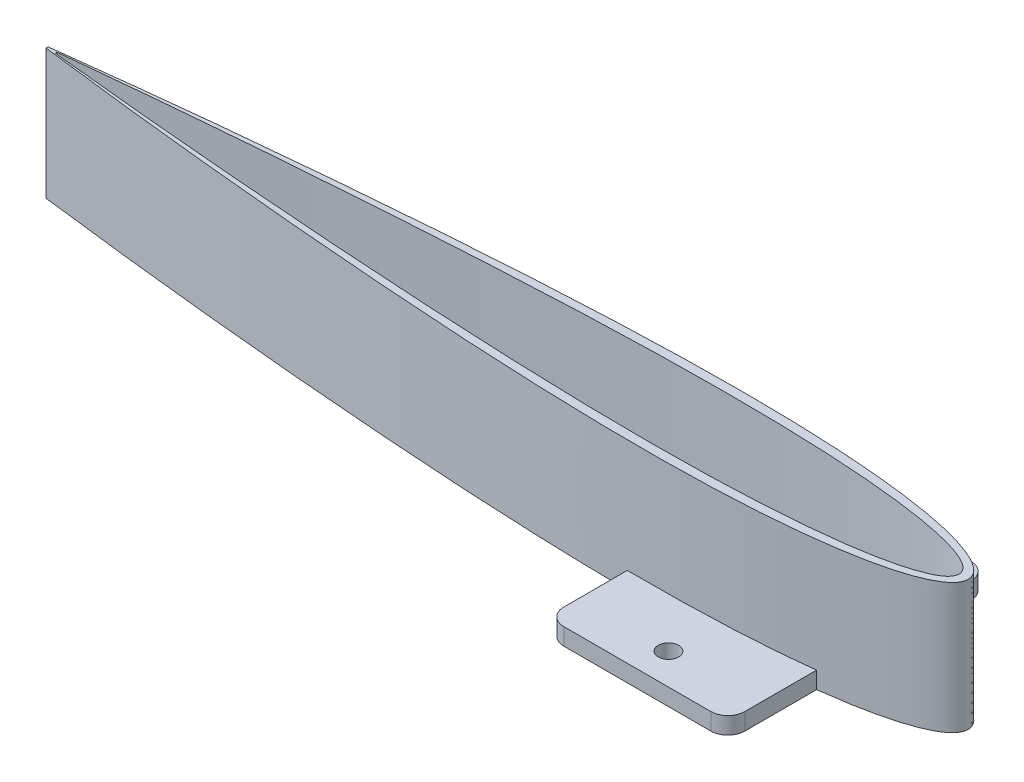
from build123d import *

# Parameters (mm, degrees)
BOSS_EXTRUDE1_DEPTH = 23
BOSS_EXTRUDE2_DEPTH = 3
CUT_EXTRUDE1_DEPTH  = 20
SKETCH4_R           = 1.8
CUT_EXTRUDE2_DEPTH  = 3


with BuildPart() as part:
    # Sketch1 → Boss-Extrude1 (new body)
    with BuildSketch(Plane(origin=(0, 0, 0), x_dir=(1, 0, 0), z_dir=(0, 1, 0))):
        with BuildLine():
            Line((-161.284, 0.18450138), (-161.284, -0.18450138))
            add(Edge.make_bspline(
                [(-161.284, 0.18450138), (-161.135285552, 0.203239863), (-160.542103526, 0.277982643), (-159.213544996, 0.444104262), (-157.015453139, 0.715408296), (-153.971872979, 1.083724041), (-150.116132303, 1.538612136), (-145.490452745, 2.067758404), (-140.145504077, 2.657679862), (-134.139845429, 3.29416917), (-127.53928397, 3.962606617), (-120.416149384, 4.648044144), (-112.848495933, 5.3351116), (-104.919240653, 6.007807533), (-96.715248395, 6.649280014), (-88.326374672, 7.241712468), (-79.84447799, 7.766420282), (-71.362413467, 8.204231159), (-62.97301895, 8.536172364), (-54.768103928, 8.744428726), (-46.837447754, 8.813478491), (-39.267816891, 8.731264117), (-32.14198666, 8.490243969), (-25.537819723, 8.088124773), (-19.527199646, 7.528268837), (-14.175386999, 6.819291704), (-9.538717204, 5.975150055), (-5.666260379, 5.01168712), (-2.58646106, 3.951109869), (-0.325415931, 2.797166623), (1.177544817, 1.549374974), (1.783091046, 0), (1.177544817, -1.549374974), (-0.325415931, -2.797166623), (-2.58646106, -3.951109869), (-5.666260379, -5.01168712), (-9.538717204, -5.975150055), (-14.175386999, -6.819291704), (-19.527199646, -7.528268837), (-25.537819723, -8.088124773), (-32.14198666, -8.490243969), (-39.267816891, -8.731264117), (-46.837447754, -8.813478491), (-54.768103928, -8.744428726), (-62.97301895, -8.536172364), (-71.362413467, -8.204231159), (-79.84447799, -7.766420282), (-88.326374672, -7.241712468), (-96.715248395, -6.649280014), (-104.919240653, -6.007807533), (-112.848495933, -5.3351116), (-120.416149384, -4.648044144), (-127.53928397, -3.962606617), (-134.139845429, -3.29416917), (-140.145504077, -2.657679862), (-145.490452745, -2.067758404), (-150.116132303, -1.538612136), (-153.971872979, -1.083724041), (-157.015453139, -0.715408296), (-159.213544996, -0.444104262), (-160.542103526, -0.277982643), (-161.135285552, -0.203239863), (-161.284, -0.18450138)],
                knots=[0, 0, 0, 0, 0.00135831, 0.005417933, 0.012133176, 0.021428608, 0.03320011, 0.047316244, 0.063619895, 0.081930134, 0.102044264, 0.123740032, 0.146778017, 0.170904207, 0.195852777, 0.221349083, 0.247112878, 0.272861715, 0.298314501, 0.323195095, 0.34723587, 0.370181113, 0.391790201, 0.411840564, 0.430130584, 0.446482834, 0.460748495, 0.472814827, 0.482620397, 0.490191984, 0.49574923, 0.5, 0.50425077, 0.509808016, 0.517379603, 0.527185173, 0.539251505, 0.553517166, 0.569869416, 0.588159436, 0.608209799, 0.629818887, 0.65276413, 0.676804905, 0.701685499, 0.727138285, 0.752887122, 0.778650917, 0.804147223, 0.829095793, 0.853221983, 0.876259968, 0.897955736, 0.918069866, 0.936380105, 0.952683756, 0.96679989, 0.978571392, 0.987866824, 0.994582067, 0.99864169, 1, 1, 1, 1], degree=3))
        make_face()
    extrude(amount=BOSS_EXTRUDE1_DEPTH)

    # Sketch2 → Boss-Extrude2 (add)
    with BuildSketch(Plane(origin=(0, 0, 0), x_dir=(1, 0, 0), z_dir=(0, 1, 0))):
        with BuildLine():
            Line((-46.9, -23), (-20.9, -23))
            ThreePointArc((-20.9, -23), (-18.778679656, -22.121320344), (-17.9, -20))
            Line((-17.9, -20), (-17.9, 20))
            ThreePointArc((-17.9, 20), (-18.778679656, 22.121320344), (-20.9, 23))
            Line((-20.9, 23), (-46.9, 23))
            ThreePointArc((-46.9, 23), (-49.021320344, 22.121320344), (-49.9, 20))
            Line((-49.9, 20), (-49.9, -20))
            ThreePointArc((-49.9, -20), (-49.021320344, -22.121320344), (-46.9, -23))
        make_face()
    extrude(amount=BOSS_EXTRUDE2_DEPTH)

    # Sketch3 → Cut-Extrude1 (cut)
    with BuildSketch(Plane(origin=(0, 23, 0), x_dir=(1, 0, 0), z_dir=(0, 1, 0))):
        with BuildLine():
            Line((-159.684, 0.15090138), (-159.684, -0.15090138))
            add(Edge.make_bspline(
                [(-159.684, 0.15090138), (-159.538206741, 0.166227398), (-158.956662871, 0.227360207), (-157.654167736, 0.363232866), (-155.499199594, 0.585135074), (-152.515342829, 0.886382703), (-148.735276621, 1.258436775), (-144.200400621, 1.691224844), (-138.960392936, 2.173718981), (-133.072663344, 2.694299117), (-126.601724472, 3.241008162), (-119.618481877, 3.801620551), (-112.199453433, 4.363565395), (-104.425926457, 4.913755218), (-96.383062672, 5.438406618), (-88.158961465, 5.922946918), (-79.843692488, 6.352093411), (-71.52830892, 6.710164856), (-63.303852195, 6.981644343), (-55.260358793, 7.151963366), (-47.485875905, 7.208432976), (-40.065498905, 7.14119841), (-33.080413103, 6.944115154), (-26.607014754, 6.615303653), (-20.715852923, 6.157651069), (-15.471178936, 5.577990947), (-10.928400576, 4.888852637), (-7.137110149, 4.100965219), (-4.125063263, 3.241407304), (-1.924485135, 2.297674875), (-0.458501505, 1.322679617), (0.189557065, 0), (-0.458501505, -1.322679617), (-1.924485135, -2.297674875), (-4.125063263, -3.241407304), (-7.137110149, -4.100965219), (-10.928400576, -4.888852637), (-15.471178936, -5.577990947), (-20.715852923, -6.157651069), (-26.607014754, -6.615303653), (-33.080413103, -6.944115154), (-40.065498905, -7.14119841), (-47.485875905, -7.208432976), (-55.260358793, -7.151963366), (-63.303852195, -6.981644343), (-71.52830892, -6.710164856), (-79.843692488, -6.352093411), (-88.158961465, -5.922946918), (-96.383062672, -5.438406618), (-104.425926457, -4.913755218), (-112.199453433, -4.363565395), (-119.618481877, -3.801620551), (-126.601724472, -3.241008162), (-133.072663344, -2.694299117), (-138.960392936, -2.173718981), (-144.200400621, -1.691224844), (-148.735276621, -1.258436775), (-152.515342829, -0.886382703), (-155.499199594, -0.585135074), (-157.654167736, -0.363232866), (-158.956662871, -0.227360207), (-159.538206741, -0.166227398), (-159.684, -0.15090138)],
                knots=[0, 0, 0, 0, 0.001360811, 0.005428038, 0.012156267, 0.021470482, 0.03326704, 0.047414968, 0.063757539, 0.082114088, 0.102282038, 0.12403911, 0.147145729, 0.171347612, 0.196378555, 0.221963406, 0.247821218, 0.273668571, 0.299222988, 0.324206394, 0.348348543, 0.371390297, 0.393086736, 0.413210068, 0.431552463, 0.44792908, 0.462181893, 0.474185722, 0.483860131, 0.491198837, 0.496361358, 0.5, 0.503638642, 0.508801163, 0.516139869, 0.525814278, 0.537818107, 0.55207092, 0.568447537, 0.586789932, 0.606913264, 0.628609703, 0.651651457, 0.675793606, 0.700777012, 0.726331429, 0.752178782, 0.778036594, 0.803621445, 0.828652388, 0.852854271, 0.87596089, 0.897717962, 0.917885912, 0.936242461, 0.952585032, 0.96673296, 0.978529518, 0.987843733, 0.994571962, 0.998639189, 1, 1, 1, 1], degree=3))
        make_face()
    extrude(amount=-CUT_EXTRUDE1_DEPTH, mode=Mode.SUBTRACT)

    # Sketch4 → Cut-Extrude2 (cut)
    with BuildSketch(Plane(origin=(0, 0, 0), x_dir=(1, 0, 0), z_dir=(0, 1, 0))):
        with Locations(Location((-33.9, -17.5, 0), (0, 0, 270))):
            Circle(SKETCH4_R)
        with Locations(Location((-33.9, 17.5, 0), (0, 0, 270))):
            Circle(SKETCH4_R)
    extrude(amount=CUT_EXTRUDE2_DEPTH, mode=Mode.SUBTRACT)


solid = part.part
